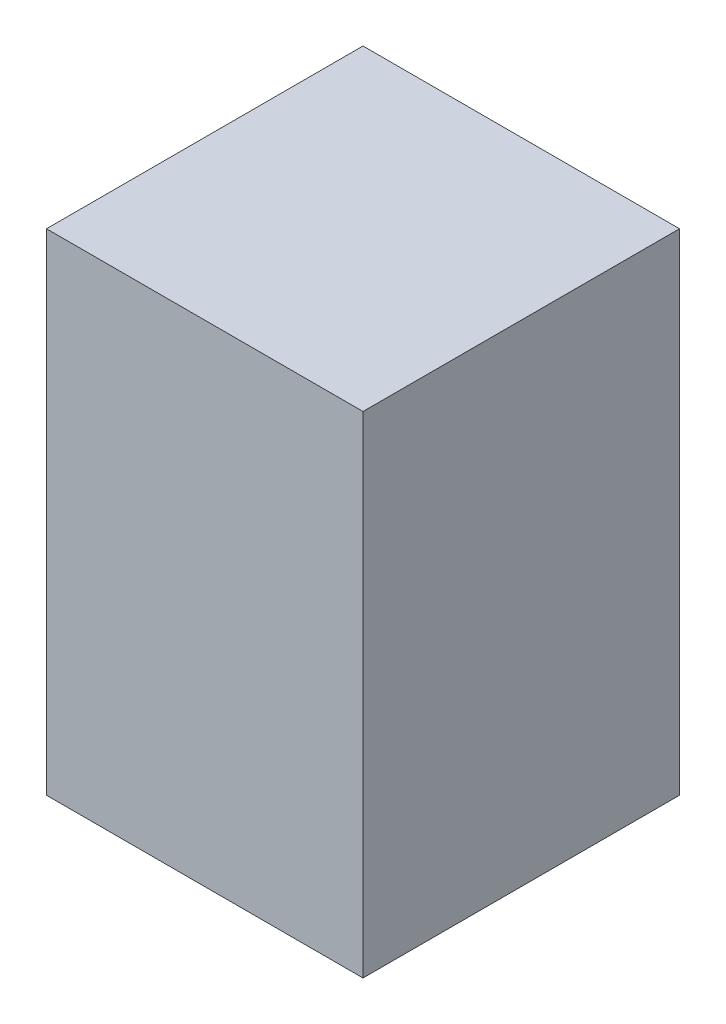
from build123d import *

# Parameters (mm, degrees)
SKETCH1_W           = 200
SKETCH1_H           = 200
BOSS_EXTRUDE1_DEPTH = 310


with BuildPart() as part:
    # Sketch1 → Boss-Extrude1 (new body)
    with BuildSketch(Plane(origin=(0, 0, 0), x_dir=(1, 0, 0), z_dir=(0, 1, 0))):
        Rectangle(SKETCH1_W, SKETCH1_H)
    extrude(amount=BOSS_EXTRUDE1_DEPTH)


solid = part.part
